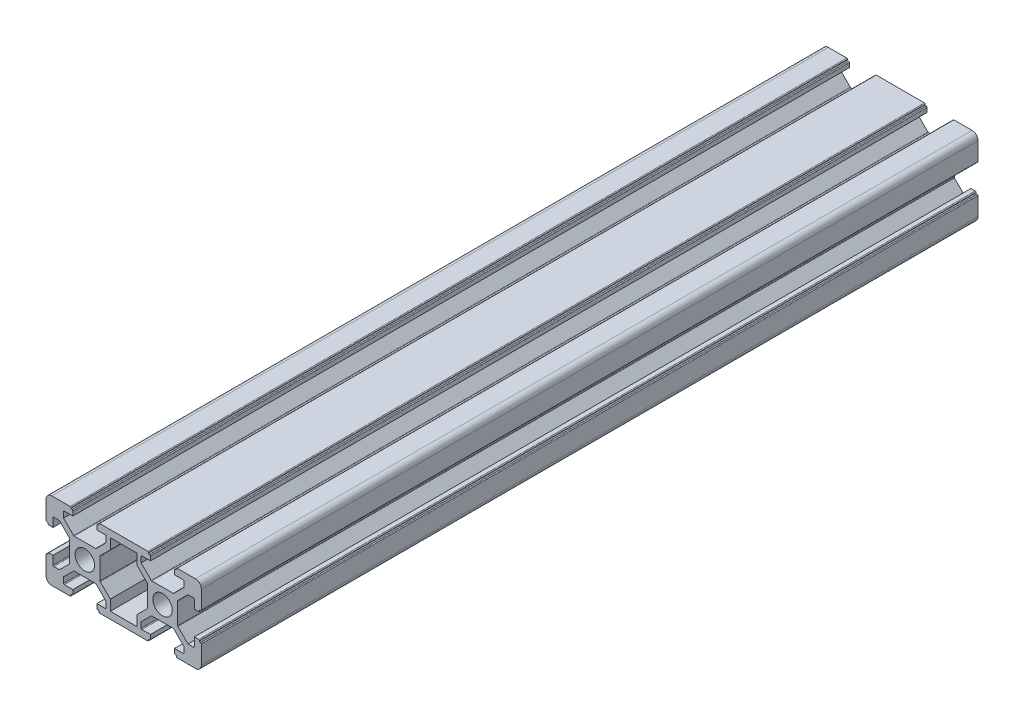
from build123d import *

# Parameters (mm, degrees)
BOSS_EXTRUDE1_DEPTH = 200
SKETCH2_R           = 2.5
CUT_EXTRUDE1_DEPTH  = 203.484567313
SKETCH4_R           = 1.5
CUT_EXTRUDE3_DEPTH  = 30


with BuildPart() as part:
    # Sketch1 → Boss-Extrude1 (new body)
    with BuildSketch(Plane.XY):
        with BuildLine():
            Line((-8.5, 10), (-3.8, 10))
            ThreePointArc((-3.8, 10), (-3.658578644, 9.941421356), (-3.6, 9.8))
            Line((-3.6, 9.8), (-3.6, 9.7))
            ThreePointArc((-3.6, 9.7), (-3.541421356, 9.558578644), (-3.4, 9.5))
            Line((-3.4, 9.5), (-3.3, 9.5))
            ThreePointArc((-3.3, 9.5), (-3.158578644, 9.441421356), (-3.1, 9.3))
            Line((-3.1, 9.3), (-3.1, 8.2))
            Line((-3.1, 8.2), (-5.3, 8.2))
            ThreePointArc((-5.3, 8.2), (-5.441421356, 8.141421356), (-5.5, 8))
            Line((-5.5, 8), (-5.5, 6.560660172))
            Line((-5.5, 6.560660172), (-2.897918472, 3.958578644))
            ThreePointArc((-2.897918472, 3.958578644), (-2.833033802, 3.915224093), (-2.756497116, 3.9))
            Line((-2.756497116, 3.9), (2.756497116, 3.9))
            ThreePointArc((2.756497116, 3.9), (2.833033802, 3.915224093), (2.897918472, 3.958578644))
            Line((2.897918472, 3.958578644), (5.5, 6.560660172))
            Line((5.5, 6.560660172), (5.5, 8))
            ThreePointArc((5.5, 8), (5.441421356, 8.141421356), (5.3, 8.2))
            Line((5.3, 8.2), (3.1, 8.2))
            Line((3.1, 8.2), (3.1, 9.3))
            ThreePointArc((3.1, 9.3), (3.158578644, 9.441421356), (3.3, 9.5))
            Line((3.3, 9.5), (3.4, 9.5))
            ThreePointArc((3.4, 9.5), (3.541421356, 9.558578644), (3.6, 9.7))
            Line((3.6, 9.7), (3.6, 9.8))
            ThreePointArc((3.6, 9.8), (3.658578644, 9.941421356), (3.8, 10))
            Line((3.8, 10), (8.5, 10))
            Line((8.5, 10), (11.5, 10))
            Line((11.5, 10), (16.2, 10))
            ThreePointArc((16.2, 10), (16.341421356, 9.941421356), (16.4, 9.8))
            Line((16.4, 9.8), (16.4, 9.7))
            ThreePointArc((16.4, 9.7), (16.458578644, 9.558578644), (16.6, 9.5))
            Line((16.6, 9.5), (16.7, 9.5))
            ThreePointArc((16.7, 9.5), (16.841421356, 9.441421356), (16.9, 9.3))
            Line((16.9, 9.3), (16.9, 8.2))
            Line((16.9, 8.2), (14.7, 8.2))
            ThreePointArc((14.7, 8.2), (14.558578644, 8.141421356), (14.5, 8))
            Line((14.5, 8), (14.5, 6.560660172))
            Line((14.5, 6.560660172), (17.102081528, 3.958578644))
            ThreePointArc((17.102081528, 3.958578644), (17.166966198, 3.915224093), (17.243502884, 3.9))
            Line((17.243502884, 3.9), (22.756497116, 3.9))
            ThreePointArc((22.756497116, 3.9), (22.833033802, 3.915224093), (22.897918472, 3.958578644))
            Line((22.897918472, 3.958578644), (25.5, 6.560660172))
            Line((25.5, 6.560660172), (25.5, 8))
            ThreePointArc((25.5, 8), (25.441421356, 8.141421356), (25.3, 8.2))
            Line((25.3, 8.2), (23.1, 8.2))
            Line((23.1, 8.2), (23.1, 9.3))
            ThreePointArc((23.1, 9.3), (23.158578644, 9.441421356), (23.3, 9.5))
            Line((23.3, 9.5), (23.4, 9.5))
            ThreePointArc((23.4, 9.5), (23.541421356, 9.558578644), (23.6, 9.7))
            Line((23.6, 9.7), (23.6, 9.8))
            ThreePointArc((23.6, 9.8), (23.658578644, 9.941421356), (23.8, 10))
            Line((23.8, 10), (28.5, 10))
            ThreePointArc((28.5, 10), (29.560660172, 9.560660172), (30, 8.5))
            Line((30, 8.5), (30, 3.8))
            ThreePointArc((30, 3.8), (29.941421356, 3.658578644), (29.8, 3.6))
            Line((29.8, 3.6), (29.7, 3.6))
            ThreePointArc((29.7, 3.6), (29.558578644, 3.541421356), (29.5, 3.4))
            Line((29.5, 3.4), (29.5, 3.3))
            ThreePointArc((29.5, 3.3), (29.441421356, 3.158578644), (29.3, 3.1))
            Line((29.3, 3.1), (28.2, 3.1))
            Line((28.2, 3.1), (28.2, 5.3))
            ThreePointArc((28.2, 5.3), (28.141421356, 5.441421356), (28, 5.5))
            Line((28, 5.5), (26.560660172, 5.5))
            Line((26.560660172, 5.5), (23.958578644, 2.897918472))
            ThreePointArc((23.958578644, 2.897918472), (23.915224093, 2.833033802), (23.9, 2.756497116))
            Line((23.9, 2.756497116), (23.9, -2.756497116))
            ThreePointArc((23.9, -2.756497116), (23.915224093, -2.833033802), (23.958578644, -2.897918472))
            Line((23.958578644, -2.897918472), (26.560660172, -5.5))
            Line((26.560660172, -5.5), (28, -5.5))
            ThreePointArc((28, -5.5), (28.141421356, -5.441421356), (28.2, -5.3))
            Line((28.2, -5.3), (28.2, -3.1))
            Line((28.2, -3.1), (29.3, -3.1))
            ThreePointArc((29.3, -3.1), (29.441421356, -3.158578644), (29.5, -3.3))
            Line((29.5, -3.3), (29.5, -3.4))
            ThreePointArc((29.5, -3.4), (29.558578644, -3.541421356), (29.7, -3.6))
            Line((29.7, -3.6), (29.8, -3.6))
            ThreePointArc((29.8, -3.6), (29.941421356, -3.658578644), (30, -3.8))
            Line((30, -3.8), (30, -8.5))
            ThreePointArc((30, -8.5), (29.560660172, -9.560660172), (28.5, -10))
            Line((28.5, -10), (23.8, -10))
            ThreePointArc((23.8, -10), (23.658578644, -9.941421356), (23.6, -9.8))
            Line((23.6, -9.8), (23.6, -9.7))
            ThreePointArc((23.6, -9.7), (23.541421356, -9.558578644), (23.4, -9.5))
            Line((23.4, -9.5), (23.3, -9.5))
            ThreePointArc((23.3, -9.5), (23.158578644, -9.441421356), (23.1, -9.3))
            Line((23.1, -9.3), (23.1, -8.2))
            Line((23.1, -8.2), (25.3, -8.2))
            ThreePointArc((25.3, -8.2), (25.441421356, -8.141421356), (25.5, -8))
            Line((25.5, -8), (25.5, -6.560660172))
            Line((25.5, -6.560660172), (22.897918472, -3.958578644))
            ThreePointArc((22.897918472, -3.958578644), (22.833033802, -3.915224093), (22.756497116, -3.9))
            Line((22.756497116, -3.9), (17.243502884, -3.9))
            ThreePointArc((17.243502884, -3.9), (17.166966198, -3.915224093), (17.102081528, -3.958578644))
            Line((17.102081528, -3.958578644), (14.5, -6.560660172))
            Line((14.5, -6.560660172), (14.5, -8))
            ThreePointArc((14.5, -8), (14.558578644, -8.141421356), (14.7, -8.2))
            Line((14.7, -8.2), (16.9, -8.2))
            Line((16.9, -8.2), (16.9, -9.3))
            ThreePointArc((16.9, -9.3), (16.841421356, -9.441421356), (16.7, -9.5))
            Line((16.7, -9.5), (16.6, -9.5))
            ThreePointArc((16.6, -9.5), (16.458578644, -9.558578644), (16.4, -9.7))
            Line((16.4, -9.7), (16.4, -9.8))
            ThreePointArc((16.4, -9.8), (16.341421356, -9.941421356), (16.2, -10))
            Line((16.2, -10), (11.5, -10))
            Line((11.5, -10), (8.5, -10))
            Line((8.5, -10), (3.8, -10))
            ThreePointArc((3.8, -10), (3.658578644, -9.941421356), (3.6, -9.8))
            Line((3.6, -9.8), (3.6, -9.7))
            ThreePointArc((3.6, -9.7), (3.541421356, -9.558578644), (3.4, -9.5))
            Line((3.4, -9.5), (3.3, -9.5))
            ThreePointArc((3.3, -9.5), (3.158578644, -9.441421356), (3.1, -9.3))
            Line((3.1, -9.3), (3.1, -8.2))
            Line((3.1, -8.2), (5.3, -8.2))
            ThreePointArc((5.3, -8.2), (5.441421356, -8.141421356), (5.5, -8))
            Line((5.5, -8), (5.5, -6.560660172))
            Line((5.5, -6.560660172), (2.897918472, -3.958578644))
            ThreePointArc((2.897918472, -3.958578644), (2.833033802, -3.915224093), (2.756497116, -3.9))
            Line((2.756497116, -3.9), (-2.756497116, -3.9))
            ThreePointArc((-2.756497116, -3.9), (-2.833033802, -3.915224093), (-2.897918472, -3.958578644))
            Line((-2.897918472, -3.958578644), (-5.5, -6.560660172))
            Line((-5.5, -6.560660172), (-5.5, -8))
            ThreePointArc((-5.5, -8), (-5.441421356, -8.141421356), (-5.3, -8.2))
            Line((-5.3, -8.2), (-3.1, -8.2))
            Line((-3.1, -8.2), (-3.1, -9.3))
            ThreePointArc((-3.1, -9.3), (-3.158578644, -9.441421356), (-3.3, -9.5))
            Line((-3.3, -9.5), (-3.4, -9.5))
            ThreePointArc((-3.4, -9.5), (-3.541421356, -9.558578644), (-3.6, -9.7))
            Line((-3.6, -9.7), (-3.6, -9.8))
            ThreePointArc((-3.6, -9.8), (-3.658578644, -9.941421356), (-3.8, -10))
            Line((-3.8, -10), (-8.5, -10))
            ThreePointArc((-8.5, -10), (-9.560660172, -9.560660172), (-10, -8.5))
            Line((-10, -8.5), (-10, -3.8))
            ThreePointArc((-10, -3.8), (-9.941421356, -3.658578644), (-9.8, -3.6))
            Line((-9.8, -3.6), (-9.7, -3.6))
            ThreePointArc((-9.7, -3.6), (-9.558578644, -3.541421356), (-9.5, -3.4))
            Line((-9.5, -3.4), (-9.5, -3.3))
            ThreePointArc((-9.5, -3.3), (-9.441421356, -3.158578644), (-9.3, -3.1))
            Line((-9.3, -3.1), (-8.2, -3.1))
            Line((-8.2, -3.1), (-8.2, -5.3))
            ThreePointArc((-8.2, -5.3), (-8.141421356, -5.441421356), (-8, -5.5))
            Line((-8, -5.5), (-6.560660172, -5.5))
            Line((-6.560660172, -5.5), (-3.958578644, -2.897918472))
            ThreePointArc((-3.958578644, -2.897918472), (-3.915224093, -2.833033802), (-3.9, -2.756497116))
            Line((-3.9, -2.756497116), (-3.9, 2.756497116))
            ThreePointArc((-3.9, 2.756497116), (-3.915224093, 2.833033802), (-3.958578644, 2.897918472))
            Line((-3.958578644, 2.897918472), (-6.560660172, 5.5))
            Line((-6.560660172, 5.5), (-8, 5.5))
            ThreePointArc((-8, 5.5), (-8.141421356, 5.441421356), (-8.2, 5.3))
            Line((-8.2, 5.3), (-8.2, 3.1))
            Line((-8.2, 3.1), (-9.3, 3.1))
            ThreePointArc((-9.3, 3.1), (-9.441421356, 3.158578644), (-9.5, 3.3))
            Line((-9.5, 3.3), (-9.5, 3.4))
            ThreePointArc((-9.5, 3.4), (-9.558578644, 3.541421356), (-9.7, 3.6))
            Line((-9.7, 3.6), (-9.8, 3.6))
            ThreePointArc((-9.8, 3.6), (-9.941421356, 3.658578644), (-10, 3.8))
            Line((-10, 3.8), (-10, 8.5))
            ThreePointArc((-10, 8.5), (-9.560660172, 9.560660172), (-8.5, 10))
        make_face()
        with BuildLine():
            Line((3.9, 2.756497116), (3.9, -2.756497116))
            ThreePointArc((3.9, -2.756497116), (3.915224093, -2.833033802), (3.958578644, -2.897918472))
            Line((3.958578644, -2.897918472), (6.560660172, -5.5))
            Line((6.560660172, -5.5), (6.560660172, -8.2))
            Line((6.560660172, -8.2), (13.439339828, -8.2))
            Line((13.439339828, -8.2), (13.439339828, -5.5))
            Line((13.439339828, -5.5), (16.041421356, -2.897918472))
            ThreePointArc((16.041421356, -2.897918472), (16.084775907, -2.833033802), (16.1, -2.756497116))
            Line((16.1, -2.756497116), (16.1, 2.756497116))
            ThreePointArc((16.1, 2.756497116), (16.084775907, 2.833033802), (16.041421356, 2.897918472))
            Line((16.041421356, 2.897918472), (13.439339828, 5.5))
            Line((13.439339828, 5.5), (13.439339828, 8.2))
            Line((13.439339828, 8.2), (6.560660172, 8.2))
            Line((6.560660172, 8.2), (6.560660172, 5.5))
            Line((6.560660172, 5.5), (3.958578644, 2.897918472))
            ThreePointArc((3.958578644, 2.897918472), (3.915224093, 2.833033802), (3.9, 2.756497116))
        make_face(mode=Mode.SUBTRACT)
    extrude(amount=BOSS_EXTRUDE1_DEPTH)

    # Sketch2 → Cut-Extrude1 (cut, through all)
    with BuildSketch(Plane.XY.offset(200)):
        Circle(SKETCH2_R)
        with Locations(Location((20, 0, 0), (0, 0, 180))):
            Circle(SKETCH2_R)
    extrude(amount=-CUT_EXTRUDE1_DEPTH, mode=Mode.SUBTRACT)

    # Sketch4 → Cut-Extrude3 (cut)
    with BuildSketch(Plane(origin=(0, 3.9, 0), x_dir=(1, 0, 0), z_dir=(0, 1, 0))):
        with Locations(Location((0, -183.3, 0), (0, 0, 270))):
            Circle(SKETCH4_R)
        with Locations(Location((0, -166.6, 0), (0, 0, 270))):
            Circle(SKETCH4_R)
        with Locations(Location((20, -166.6, 0), (0, 0, 270))):
            Circle(SKETCH4_R)
        with Locations(Location((20, -183.3, 0), (0, 0, 270))):
            Circle(SKETCH4_R)
    extrude(amount=-CUT_EXTRUDE3_DEPTH, mode=Mode.SUBTRACT)


solid = part.part
